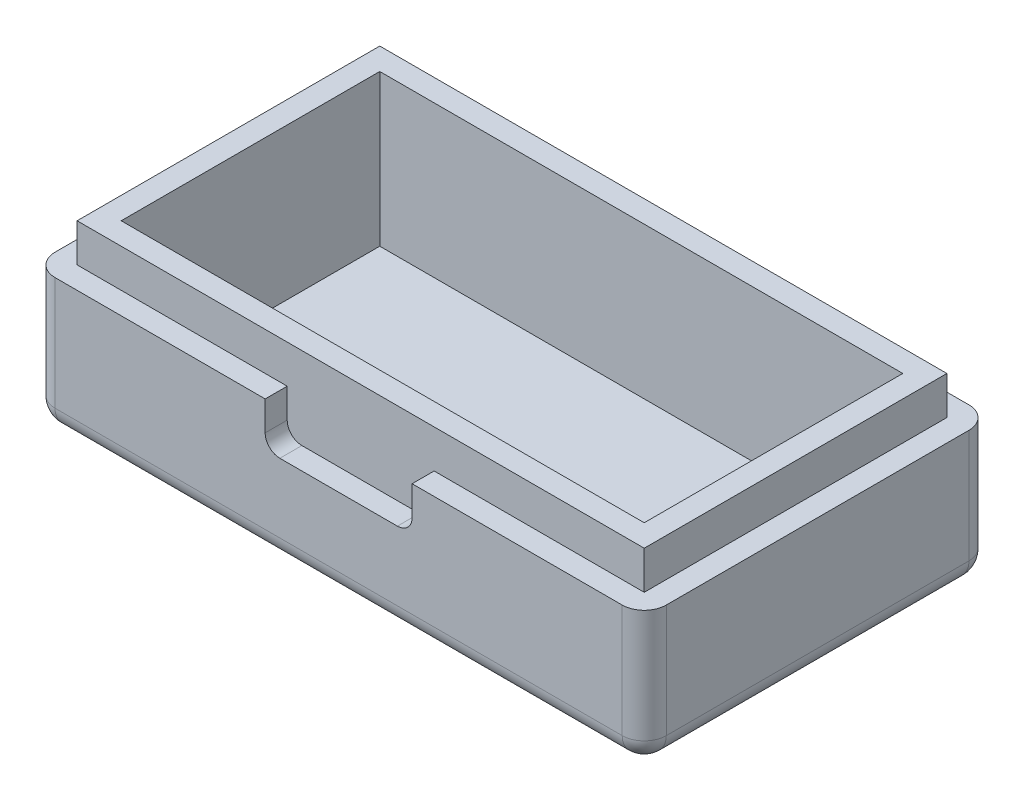
from build123d import *

# Parameters (mm, degrees)
SKETCH1_W           = 41.6
SKETCH1_H           = 23.6
BOSS_EXTRUDE1_DEPTH = 11.8
SKETCH2_W           = 35.6
SKETCH2_H           = 17.6
CUT_EXTRUDE1_DEPTH  = 10.3
SKETCH4_W           = 41.6
SKETCH4_H           = 23.6
SKETCH4_W_2         = 38.6
SKETCH4_H_2         = 20.6
CUT_EXTRUDE2_DEPTH  = 2.6
FILLET1_R           = 1.5
CUT_EXTRUDE3_DEPTH  = 1.5
CUT_EXTRUDE4_START  = -1.5
CUT_EXTRUDE4_DEPTH  = 1.5


with BuildPart() as part:
    # Sketch1 → Boss-Extrude1 (new body)
    with BuildSketch(Plane(origin=(0, 0, 0), x_dir=(1, 0, 0), z_dir=(0, 1, 0))):
        with Locations((20.8, 11.8)):
            Rectangle(SKETCH1_W, SKETCH1_H)
    extrude(amount=BOSS_EXTRUDE1_DEPTH)

    # Sketch2 → Cut-Extrude1 (cut)
    with BuildSketch(Plane(origin=(0, 11.8, 0), x_dir=(1, 0, 0), z_dir=(0, 1, 0))):
        with Locations((20.8, 11.8)):
            Rectangle(SKETCH2_W, SKETCH2_H)
    extrude(amount=-CUT_EXTRUDE1_DEPTH, mode=Mode.SUBTRACT)

    # Sketch4 → Cut-Extrude2 (cut)
    with BuildSketch(Plane(origin=(0, 11.8, 0), x_dir=(1, 0, 0), z_dir=(0, 1, 0))):
        with Locations((20.8, 11.8)):
            Rectangle(SKETCH4_W, SKETCH4_H)
        with Locations((20.8, 11.8)):
            Rectangle(SKETCH4_W_2, SKETCH4_H_2, mode=Mode.SUBTRACT)
    extrude(amount=-CUT_EXTRUDE2_DEPTH, mode=Mode.SUBTRACT)

    # Fillet1
    fillet1_edges = [part.edges().sort_by_distance(p)[0] for p in [
        (0, 4.6, -23.6),
        (41.6, 4.6, -23.6),
        (41.6, 4.6, 0),
        (0, 4.6, 0),
        (20.8, 0, -23.6),
        (41.6, 0, -11.8),
        (20.8, 0, 0),
        (0, 0, -11.8),
    ]]
    fillet(fillet1_edges, radius=FILLET1_R)

    # Sketch5 → Cut-Extrude3 (cut)
    with BuildSketch(Plane(origin=(0, 0, -23.6), x_dir=(-1, 0, 0), z_dir=(0, 0, -1))):
        with BuildLine():
            Line((-25.8, 9.2), (-15.8, 9.2))
            Line((-15.8, 9.2), (-15.8, 7.2))
            ThreePointArc((-15.8, 7.2), (-16.092893219, 6.492893219), (-16.8, 6.2))
            Line((-16.8, 6.2), (-24.8, 6.2))
            ThreePointArc((-24.8, 6.2), (-25.507106781, 6.492893219), (-25.8, 7.2))
            Line((-25.8, 7.2), (-25.8, 9.2))
        make_face()
    extrude(amount=-CUT_EXTRUDE3_DEPTH, mode=Mode.SUBTRACT)

    # Sketch6 → Cut-Extrude4 (cut)
    with BuildSketch(Plane.XY.offset(CUT_EXTRUDE4_START)):
        with BuildLine():
            Line((15.8, 9.2), (25.8, 9.2))
            Line((25.8, 9.2), (25.8, 7.2))
            ThreePointArc((25.8, 7.2), (25.507106781, 6.492893219), (24.8, 6.2))
            Line((24.8, 6.2), (16.8, 6.2))
            ThreePointArc((16.8, 6.2), (16.092893219, 6.492893219), (15.8, 7.2))
            Line((15.8, 7.2), (15.8, 9.2))
        make_face()
    extrude(amount=CUT_EXTRUDE4_DEPTH, mode=Mode.SUBTRACT)


solid = part.part
